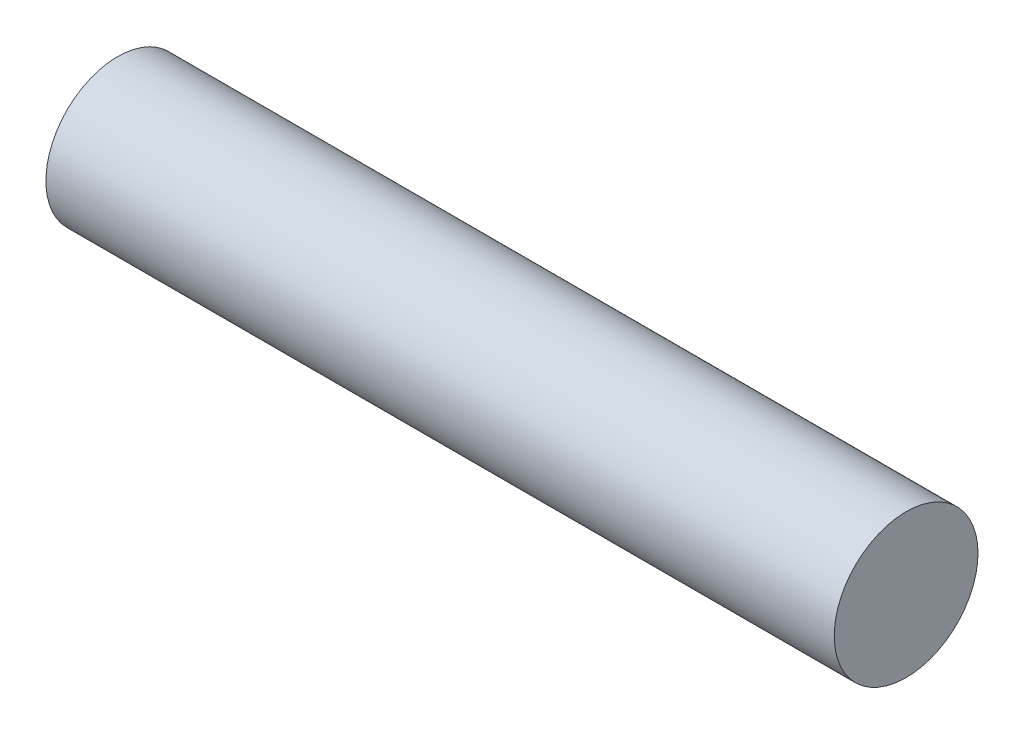
from build123d import *

# Parameters (mm, degrees)
SKETCH1_R           = 37.8
BOSS_EXTRUDE1_DEPTH = 207.25


with BuildPart() as part:
    # Sketch1 → Boss-Extrude1 (new, symmetric)
    with BuildSketch(Plane(origin=(0, 0, 0), x_dir=(0, 0, -1), z_dir=(1, 0, 0))):
        Circle(SKETCH1_R)
    extrude(amount=BOSS_EXTRUDE1_DEPTH, both=True)


solid = part.part
